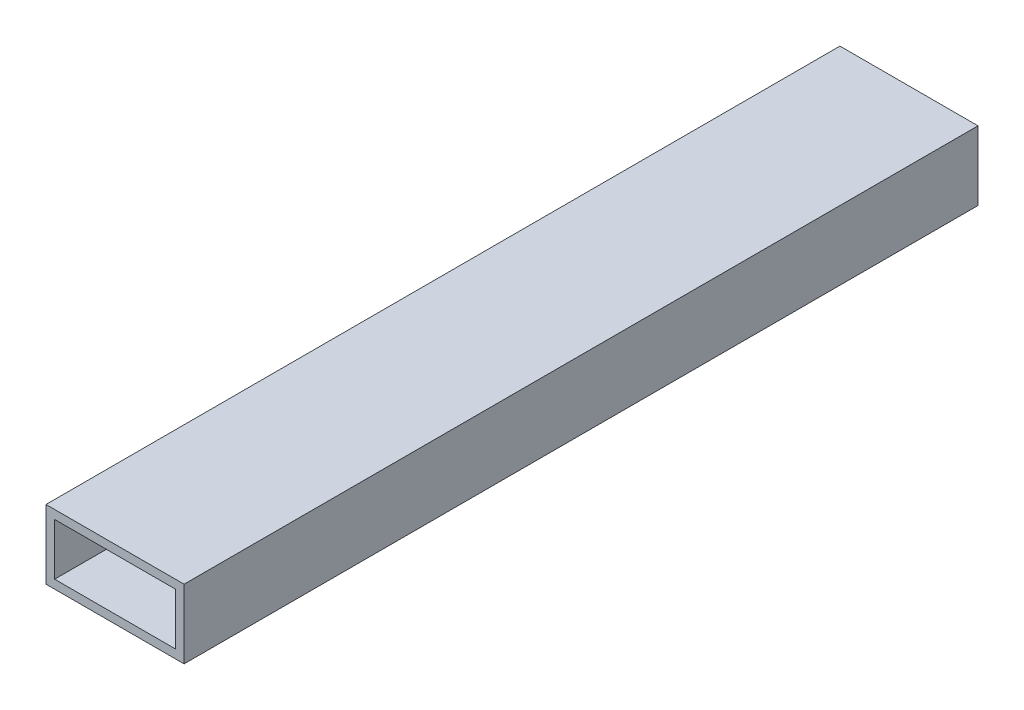
from build123d import *

# Parameters (mm, degrees)
SKETCH1_W           = 50.8
SKETCH1_H           = 25.4
SKETCH1_W_2         = 44.45
SKETCH1_H_2         = 19.05
BOSS_EXTRUDE1_DEPTH = 292.1


with BuildPart() as part:
    # Sketch1 → Boss-Extrude1 (new body)
    with BuildSketch(Plane.XY):
        with Locations((25.4, 12.7)):
            Rectangle(SKETCH1_W, SKETCH1_H)
        with Locations((25.4, 12.7)):
            Rectangle(SKETCH1_W_2, SKETCH1_H_2, mode=Mode.SUBTRACT)
    extrude(amount=BOSS_EXTRUDE1_DEPTH)


solid = part.part
